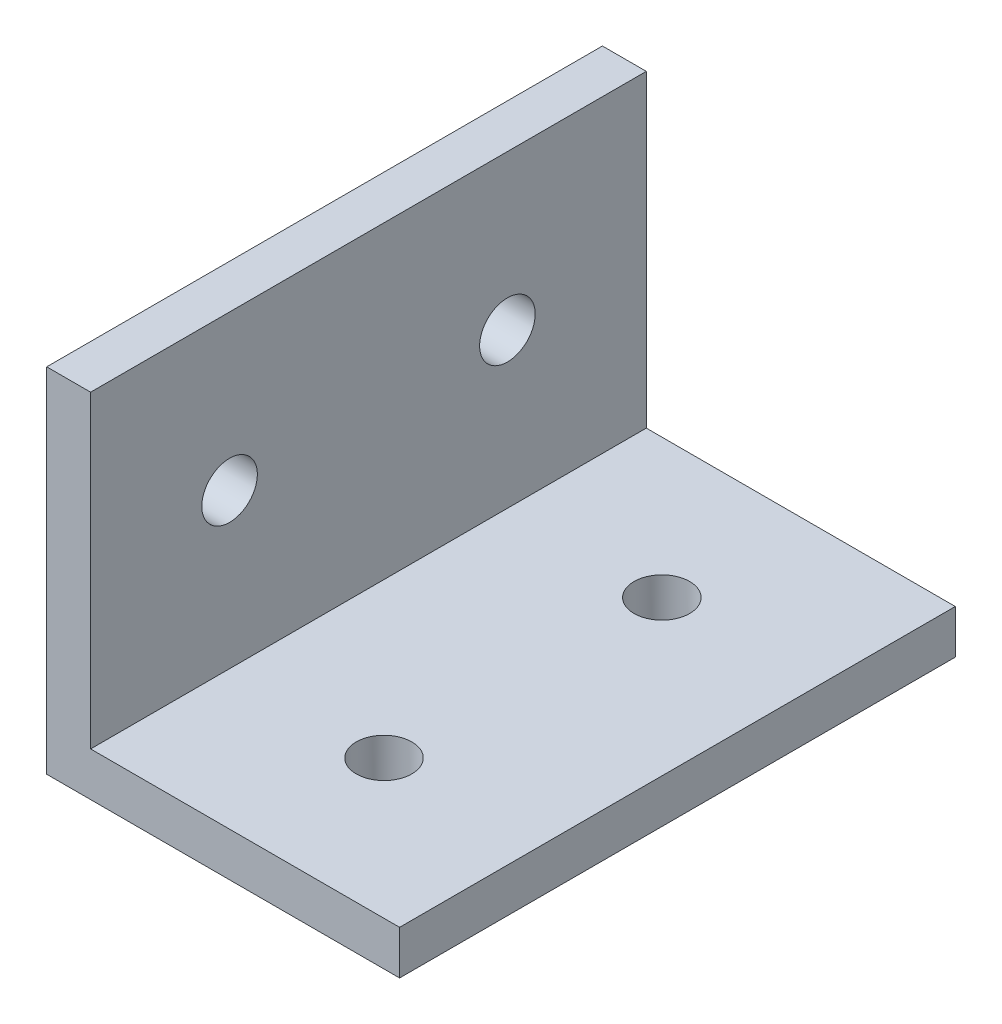
from build123d import *

# Parameters (mm, degrees)
BOSS_EXTRUDE1_DEPTH = 20
CUT_EXTRUDE1_REACH  = 28.881
CIRPATTERN1_COUNT   = 2
CIRPATTERN1_ANGLE   = 90


with BuildPart() as part:
    # Sketch1 → Boss-Extrude1 (new body)
    with BuildSketch(Plane.XY):
        Polygon((0, 0), (0, 12.7), (1.58, 12.7), (1.58, 1.58), (12.7, 1.58), (12.7, 0), align=None)
    extrude(amount=BOSS_EXTRUDE1_DEPTH)

    # Sketch2 → Cut-Extrude1 (cut, up to next)
    with BuildSketch(Plane.ZY, mode=Mode.PRIVATE) as cut_extrude1_sk1:
        with BuildLine():
            ThreePointArc((4, 7.14), (5, 6.14), (6, 7.14))
            Line((6, 7.14), (4, 7.14))
        make_face()
    cut_extrude1_tool1 = extrude(cut_extrude1_sk1.sketch, amount=-CUT_EXTRUDE1_REACH, mode=Mode.PRIVATE) & part.part
    # Sketch2 → Cut-Extrude1 (cut, up to next)
    with BuildSketch(Plane.ZY, mode=Mode.PRIVATE) as cut_extrude1_sk2:
        with BuildLine():
            Line((4, 7.14), (6, 7.14))
            ThreePointArc((6, 7.14), (5, 8.14), (4, 7.14))
        make_face()
    cut_extrude1_tool2 = extrude(cut_extrude1_sk2.sketch, amount=-CUT_EXTRUDE1_REACH, mode=Mode.PRIVATE) & part.part
    # Sketch2 → Cut-Extrude1 (cut, up to next)
    with BuildSketch(Plane.ZY, mode=Mode.PRIVATE) as cut_extrude1_sk3:
        with BuildLine():
            ThreePointArc((4, 7.14), (5, 6.14), (6, 7.14))
            Line((6, 7.14), (4, 7.14))
        make_face()
    cut_extrude1_tool3 = extrude(cut_extrude1_sk3.sketch, amount=-CUT_EXTRUDE1_REACH, mode=Mode.PRIVATE) & part.part
    # Sketch2 → Cut-Extrude1 (cut, up to next)
    with BuildSketch(Plane.ZY, mode=Mode.PRIVATE) as cut_extrude1_sk4:
        with BuildLine():
            Line((4, 7.14), (6, 7.14))
            ThreePointArc((6, 7.14), (5, 8.14), (4, 7.14))
        make_face()
    cut_extrude1_tool4 = extrude(cut_extrude1_sk4.sketch, amount=-CUT_EXTRUDE1_REACH, mode=Mode.PRIVATE) & part.part
    # Sketch2 → Cut-Extrude1 (cut, up to next)
    with BuildSketch(Plane.ZY, mode=Mode.PRIVATE) as cut_extrude1_sk5:
        with BuildLine():
            ThreePointArc((16, 7.14), (15, 8.14), (14, 7.14))
            Line((14, 7.14), (16, 7.14))
        make_face()
    cut_extrude1_tool5 = extrude(cut_extrude1_sk5.sketch, amount=-CUT_EXTRUDE1_REACH, mode=Mode.PRIVATE) & part.part
    # Sketch2 → Cut-Extrude1 (cut, up to next)
    with BuildSketch(Plane.ZY, mode=Mode.PRIVATE) as cut_extrude1_sk6:
        with BuildLine():
            Line((16, 7.14), (14, 7.14))
            ThreePointArc((14, 7.14), (15, 6.14), (16, 7.14))
        make_face()
    cut_extrude1_tool6 = extrude(cut_extrude1_sk6.sketch, amount=-CUT_EXTRUDE1_REACH, mode=Mode.PRIVATE) & part.part
    # Sketch2 → Cut-Extrude1 (cut, up to next)
    with BuildSketch(Plane.ZY, mode=Mode.PRIVATE) as cut_extrude1_sk7:
        with BuildLine():
            ThreePointArc((16, 7.14), (15, 8.14), (14, 7.14))
            Line((14, 7.14), (16, 7.14))
        make_face()
    cut_extrude1_tool7 = extrude(cut_extrude1_sk7.sketch, amount=-CUT_EXTRUDE1_REACH, mode=Mode.PRIVATE) & part.part
    # Sketch2 → Cut-Extrude1 (cut, up to next)
    with BuildSketch(Plane.ZY, mode=Mode.PRIVATE) as cut_extrude1_sk8:
        with BuildLine():
            Line((16, 7.14), (14, 7.14))
            ThreePointArc((14, 7.14), (15, 6.14), (16, 7.14))
        make_face()
    cut_extrude1_tool8 = extrude(cut_extrude1_sk8.sketch, amount=-CUT_EXTRUDE1_REACH, mode=Mode.PRIVATE) & part.part
    cut_extrude1_1 = cut_extrude1_tool1.solids().sort_by_distance((0, 6.715587, 5))[0]
    add(cut_extrude1_1, mode=Mode.SUBTRACT)
    cut_extrude1_2 = cut_extrude1_tool2.solids().sort_by_distance((0, 7.564413, 5))[0]
    add(cut_extrude1_2, mode=Mode.SUBTRACT)
    cut_extrude1_3 = cut_extrude1_tool3.solids().sort_by_distance((0, 6.715587, 5))[0]
    add(cut_extrude1_3, mode=Mode.SUBTRACT)
    cut_extrude1_4 = cut_extrude1_tool4.solids().sort_by_distance((0, 7.564413, 5))[0]
    add(cut_extrude1_4, mode=Mode.SUBTRACT)
    cut_extrude1_5 = cut_extrude1_tool5.solids().sort_by_distance((0, 7.564413, 15))[0]
    add(cut_extrude1_5, mode=Mode.SUBTRACT)
    cut_extrude1_6 = cut_extrude1_tool6.solids().sort_by_distance((0, 6.715587, 15))[0]
    add(cut_extrude1_6, mode=Mode.SUBTRACT)
    cut_extrude1_7 = cut_extrude1_tool7.solids().sort_by_distance((0, 7.564413, 15))[0]
    add(cut_extrude1_7, mode=Mode.SUBTRACT)
    cut_extrude1_8 = cut_extrude1_tool8.solids().sort_by_distance((0, 6.715587, 15))[0]
    add(cut_extrude1_8, mode=Mode.SUBTRACT)
    cut_extrude1 = cut_extrude1_1 + cut_extrude1_2 + cut_extrude1_3 + cut_extrude1_4 + cut_extrude1_5 + cut_extrude1_6 + cut_extrude1_7 + cut_extrude1_8  # Cut-Extrude1 as one shape, for the pattern or mirror that repeats it

    # CirPattern1: Cut-Extrude1; each copy of Cut-Extrude1 runs up to whatever stops it at its own place
    cirpattern1_before = part.part  # the part as the pattern finds it: every copy runs up to it
    cirpattern1_cut_extrude1_long1 = extrude(cut_extrude1_sk1.sketch, amount=-CUT_EXTRUDE1_REACH, mode=Mode.PRIVATE)
    cirpattern1_cut_extrude1_long2 = extrude(cut_extrude1_sk2.sketch, amount=-CUT_EXTRUDE1_REACH, mode=Mode.PRIVATE)
    cirpattern1_cut_extrude1_long3 = extrude(cut_extrude1_sk3.sketch, amount=-CUT_EXTRUDE1_REACH, mode=Mode.PRIVATE)
    cirpattern1_cut_extrude1_long4 = extrude(cut_extrude1_sk4.sketch, amount=-CUT_EXTRUDE1_REACH, mode=Mode.PRIVATE)
    cirpattern1_cut_extrude1_long5 = extrude(cut_extrude1_sk5.sketch, amount=-CUT_EXTRUDE1_REACH, mode=Mode.PRIVATE)
    cirpattern1_cut_extrude1_long6 = extrude(cut_extrude1_sk6.sketch, amount=-CUT_EXTRUDE1_REACH, mode=Mode.PRIVATE)
    cirpattern1_cut_extrude1_long7 = extrude(cut_extrude1_sk7.sketch, amount=-CUT_EXTRUDE1_REACH, mode=Mode.PRIVATE)
    cirpattern1_cut_extrude1_long8 = extrude(cut_extrude1_sk8.sketch, amount=-CUT_EXTRUDE1_REACH, mode=Mode.PRIVATE)
    cirpattern1_cut_extrude1_tool1_1 = cirpattern1_cut_extrude1_long1.rotate(Axis((1.58, 1.58, 20), (0, 0, -1)), 1 * CIRPATTERN1_ANGLE / (CIRPATTERN1_COUNT - 1)) & cirpattern1_before
    add(cirpattern1_cut_extrude1_tool1_1.solids().sort_by_distance((6.715587, 3.16, 5))[0], mode=Mode.SUBTRACT)
    cirpattern1_cut_extrude1_tool2_1 = cirpattern1_cut_extrude1_long2.rotate(Axis((1.58, 1.58, 20), (0, 0, -1)), 1 * CIRPATTERN1_ANGLE / (CIRPATTERN1_COUNT - 1)) & cirpattern1_before
    add(cirpattern1_cut_extrude1_tool2_1.solids().sort_by_distance((7.564413, 3.16, 5))[0], mode=Mode.SUBTRACT)
    cirpattern1_cut_extrude1_tool3_1 = cirpattern1_cut_extrude1_long3.rotate(Axis((1.58, 1.58, 20), (0, 0, -1)), 1 * CIRPATTERN1_ANGLE / (CIRPATTERN1_COUNT - 1)) & cirpattern1_before
    add(cirpattern1_cut_extrude1_tool3_1.solids().sort_by_distance((6.715587, 3.16, 5))[0], mode=Mode.SUBTRACT)
    cirpattern1_cut_extrude1_tool4_1 = cirpattern1_cut_extrude1_long4.rotate(Axis((1.58, 1.58, 20), (0, 0, -1)), 1 * CIRPATTERN1_ANGLE / (CIRPATTERN1_COUNT - 1)) & cirpattern1_before
    add(cirpattern1_cut_extrude1_tool4_1.solids().sort_by_distance((7.564413, 3.16, 5))[0], mode=Mode.SUBTRACT)
    cirpattern1_cut_extrude1_tool5_1 = cirpattern1_cut_extrude1_long5.rotate(Axis((1.58, 1.58, 20), (0, 0, -1)), 1 * CIRPATTERN1_ANGLE / (CIRPATTERN1_COUNT - 1)) & cirpattern1_before
    add(cirpattern1_cut_extrude1_tool5_1.solids().sort_by_distance((7.564413, 3.16, 15))[0], mode=Mode.SUBTRACT)
    cirpattern1_cut_extrude1_tool6_1 = cirpattern1_cut_extrude1_long6.rotate(Axis((1.58, 1.58, 20), (0, 0, -1)), 1 * CIRPATTERN1_ANGLE / (CIRPATTERN1_COUNT - 1)) & cirpattern1_before
    add(cirpattern1_cut_extrude1_tool6_1.solids().sort_by_distance((6.715587, 3.16, 15))[0], mode=Mode.SUBTRACT)
    cirpattern1_cut_extrude1_tool7_1 = cirpattern1_cut_extrude1_long7.rotate(Axis((1.58, 1.58, 20), (0, 0, -1)), 1 * CIRPATTERN1_ANGLE / (CIRPATTERN1_COUNT - 1)) & cirpattern1_before
    add(cirpattern1_cut_extrude1_tool7_1.solids().sort_by_distance((7.564413, 3.16, 15))[0], mode=Mode.SUBTRACT)
    cirpattern1_cut_extrude1_tool8_1 = cirpattern1_cut_extrude1_long8.rotate(Axis((1.58, 1.58, 20), (0, 0, -1)), 1 * CIRPATTERN1_ANGLE / (CIRPATTERN1_COUNT - 1)) & cirpattern1_before
    add(cirpattern1_cut_extrude1_tool8_1.solids().sort_by_distance((6.715587, 3.16, 15))[0], mode=Mode.SUBTRACT)


solid = part.part
